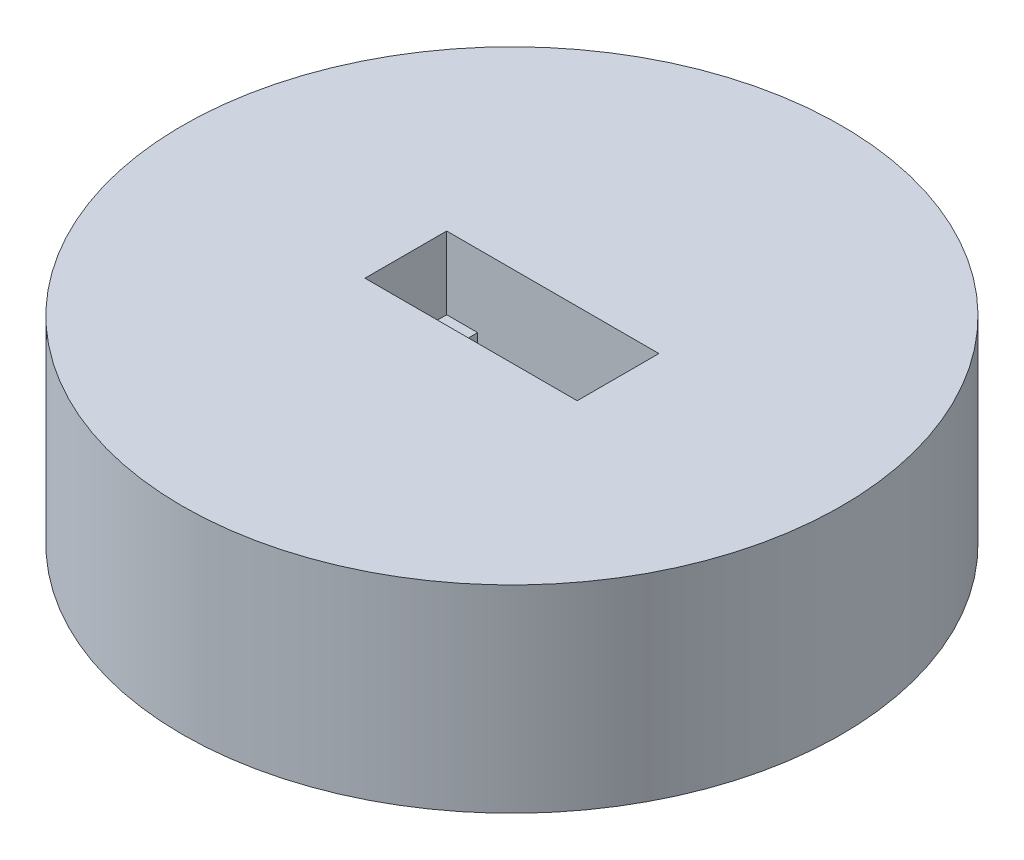
from build123d import *

# Parameters (mm, degrees)
SKETCH1_R           = 50
BOSS_EXTRUDE1_DEPTH = 30
SKETCH2_W           = 22.8
SKETCH2_H           = 12.4
CUT_EXTRUDE1_DEPTH  = 27
SKETCH3_W           = 4
SKETCH3_H           = 1.5
CUT_EXTRUDE2_DEPTH  = 77.811457479
SKETCH4_W           = 32.2
SKETCH4_H           = 12.4
CUT_EXTRUDE3_DEPTH  = 11
CUT_EXTRUDE6_START  = -3
SKETCH5_W           = 58.2
SKETCH5_H           = 48.4
SKETCH5_W_2         = 38.2
SKETCH5_H_2         = 18.4
CUT_EXTRUDE6_DEPTH  = 25
CUT_EXTRUDE9_START  = -3
SKETCH6_R           = 45
SKETCH6_R_2         = 22.113575547
CUT_EXTRUDE9_DEPTH  = 25


with BuildPart() as part:
    # Sketch1 → Boss-Extrude1 (new body)
    with BuildSketch(Plane(origin=(0, 0, 0), x_dir=(1, 0, 0), z_dir=(0, 1, 0))):
        with Locations(Location((0, 0, 0), (0, 0, 270))):
            Circle(SKETCH1_R)
    extrude(amount=BOSS_EXTRUDE1_DEPTH)

    # Sketch2 → Cut-Extrude1 (cut)
    with BuildSketch(Plane(origin=(0, 30, 0), x_dir=(1, 0, 0), z_dir=(0, 1, 0))):
        Rectangle(SKETCH2_W, SKETCH2_H)
    extrude(amount=-CUT_EXTRUDE1_DEPTH, mode=Mode.SUBTRACT)

    # Sketch3 → Cut-Extrude2 (cut, through all)
    with BuildSketch(Plane(origin=(0, 0, 0), x_dir=(0, 0, -1), z_dir=(1, 0, 0))):
        with Locations((0, 8.25)):
            Rectangle(SKETCH3_W, SKETCH3_H)
    extrude(amount=-CUT_EXTRUDE2_DEPTH, mode=Mode.SUBTRACT)

    # Sketch4 → Cut-Extrude3 (cut)
    with BuildSketch(Plane(origin=(0, 30, 0), x_dir=(1, 0, 0), z_dir=(0, 1, 0))):
        Rectangle(SKETCH4_W, SKETCH4_H)
    extrude(amount=-CUT_EXTRUDE3_DEPTH, mode=Mode.SUBTRACT)

    # Sketch5 → Cut-Extrude6 (cut)
    with BuildSketch(Plane(origin=(0, 30, 0), x_dir=(1, 0, 0), z_dir=(0, 1, 0)).offset(CUT_EXTRUDE6_START)):
        Rectangle(SKETCH5_W, SKETCH5_H)
        Rectangle(SKETCH5_W_2, SKETCH5_H_2, mode=Mode.SUBTRACT)
    extrude(amount=-CUT_EXTRUDE6_DEPTH, mode=Mode.SUBTRACT)

    # Sketch6 → Cut-Extrude9 (cut)
    with BuildSketch(Plane(origin=(0, 30, 0), x_dir=(1, 0, 0), z_dir=(0, 1, 0)).offset(CUT_EXTRUDE9_START)):
        with Locations(Location((0, 0, 0), (0, 0, 270))):
            Circle(SKETCH6_R)
        Circle(SKETCH6_R_2, mode=Mode.SUBTRACT)
    extrude(amount=-CUT_EXTRUDE9_DEPTH, mode=Mode.SUBTRACT)


solid = part.part
